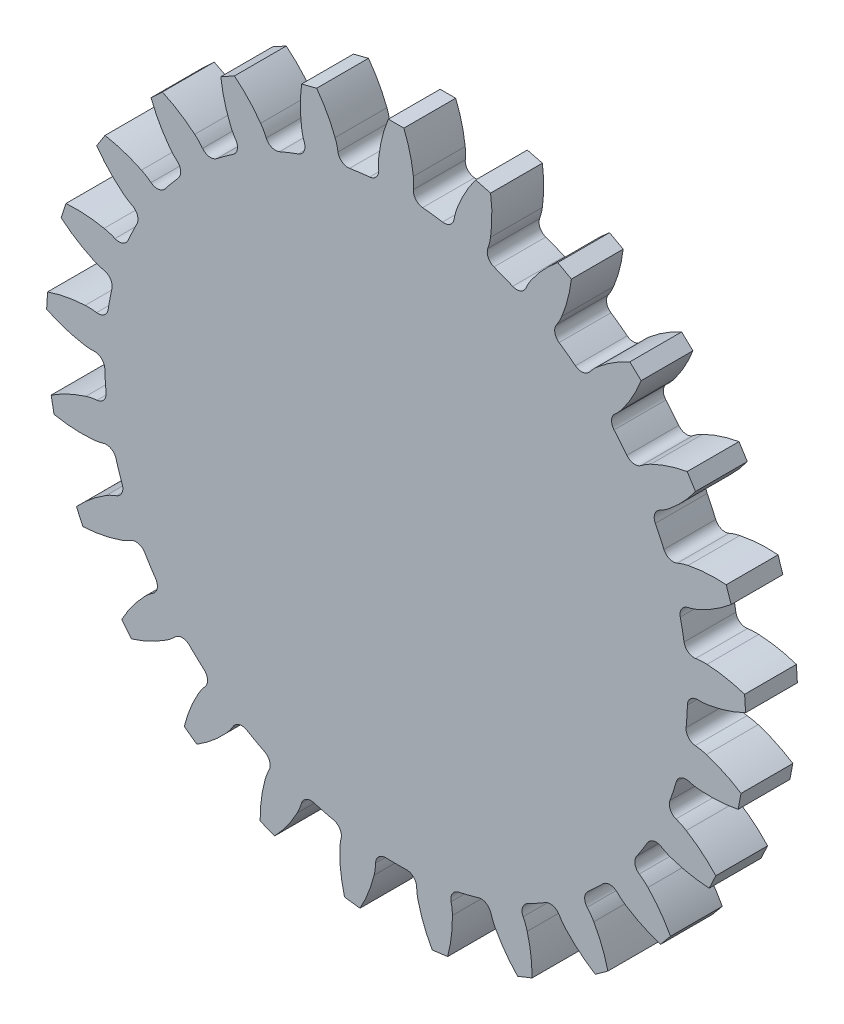
from build123d import *

# Parameters (mm, degrees)
EXTRUDE_1_DEPTH = 3


with BuildPart() as part:
    # 草图1 → 凸台-拉伸1 (new body)
    with BuildSketch(Plane.XY.offset(3)):
        with BuildLine():
            Line((17.338520252, 10.470391265), (16.856276136, 11.230286398))
            ThreePointArc((16.856276136, 11.230286398), (15.778076062, 10.959701062), (14.747362308, 10.543334659))
            ThreePointArc((14.747362308, 10.543334659), (14.459005799, 10.384007926), (14.188692914, 10.195685255))
            ThreePointArc((14.188692914, 10.195685255), (13.755799089, 10.077410904), (13.366485285, 10.300616298))
            ThreePointArc((13.366485285, 10.300616298), (13.002410972, 10.756529827), (12.622793648, 11.19958506))
            ThreePointArc((12.622793648, 11.19958506), (12.476491968, 11.623827566), (12.673787568, 12.026891248))
            ThreePointArc((12.673787568, 12.026891248), (12.909426112, 12.257127998), (13.119963351, 12.510522069))
            ThreePointArc((13.119963351, 12.510522069), (13.722091259, 13.444959765), (14.189918332, 14.453359315))
            Line((14.189918332, 14.453359315), (13.533846568, 15.06945171))
            ThreePointArc((13.533846568, 15.06945171), (12.556811968, 14.539229855), (11.662026096, 13.879616281))
            ThreePointArc((11.662026096, 13.879616281), (11.422351784, 13.653583743), (11.207365219, 13.403953493))
            ThreePointArc((11.207365219, 13.403953493), (10.817485185, 13.181738633), (10.384893466, 13.301113213))
            ThreePointArc((10.384893466, 13.301113213), (9.918876132, 13.65216178), (9.441001829, 13.986890629))
            ThreePointArc((9.441001829, 13.986890629), (9.193791665, 14.361421028), (9.284650999, 14.800887144))
            ThreePointArc((9.284650999, 14.800887144), (9.455628973, 15.082491506), (9.596535255, 15.380283219))
            ThreePointArc((9.596535255, 15.380283219), (9.947361002, 16.435106957), (10.149711657, 17.528169643))
            Line((10.149711657, 17.528169643), (9.361035645, 17.96174795))
            ThreePointArc((9.361035645, 17.96174795), (8.546557198, 17.205205365), (7.843921895, 16.343790567))
            ThreePointArc((7.843921895, 16.343790567), (7.667989398, 16.065254679), (7.52183755, 15.770002038))
            ThreePointArc((7.52183755, 15.770002038), (7.199468903, 15.457809245), (6.750780597, 15.465852266))
            ThreePointArc((6.750780597, 15.465852266), (6.212101827, 15.689978199), (5.665997144, 15.895348419))
            ThreePointArc((5.665997144, 15.895348419), (5.333411618, 16.196633589), (5.312125661, 16.644888866))
            ThreePointArc((5.312125661, 16.644888866), (5.40769989, 16.960166603), (5.470121555, 17.283644609))
            ThreePointArc((5.470121555, 17.283644609), (5.54760147, 18.392575935), (5.471761271, 19.501620609))
            Line((5.471761271, 19.501620609), (4.600036426, 19.725441507))
            ThreePointArc((4.600036426, 19.725441507), (3.999290807, 18.790114546), (3.532955233, 17.781024383))
            ThreePointArc((3.532955233, 17.781024383), (3.431819037, 17.467486579), (3.363685164, 17.145163357))
            ThreePointArc((3.363685164, 17.145163357), (3.129083511, 16.762608851), (2.692491356, 16.658814943))
            ThreePointArc((2.692491356, 16.658814943), (2.114998316, 16.741935585), (1.534977019, 16.805043009))
            ThreePointArc((1.534977019, 16.805043009), (1.137913705, 17.014152095), (1.005819931, 17.443031006))
            ThreePointArc((1.005819931, 17.443031006), (1.019985135, 17.772172057), (1, 18.101011043))
            ThreePointArc((1, 18.101011043), (0.799265734, 19.194371724), (0.45, 20.249713029))
            Line((0.45, 20.249713029), (-0.45, 20.249713029))
            ThreePointArc((-0.45, 20.249713029), (-0.799265734, 19.194371724), (-1, 18.101011043))
            ThreePointArc((-1, 18.101011043), (-1.019985135, 17.772172057), (-1.005819931, 17.443031006))
            ThreePointArc((-1.005819931, 17.443031006), (-1.137913705, 17.014152095), (-1.534977019, 16.805043009))
            ThreePointArc((-1.534977019, 16.805043009), (-2.114998316, 16.741935585), (-2.692491356, 16.658814943))
            ThreePointArc((-2.692491356, 16.658814943), (-3.129083511, 16.762608851), (-3.363685164, 17.145163357))
            ThreePointArc((-3.363685164, 17.145163357), (-3.431819037, 17.467486579), (-3.532955233, 17.781024383))
            ThreePointArc((-3.532955233, 17.781024383), (-3.999290807, 18.790114546), (-4.600036426, 19.725441507))
            Line((-4.600036426, 19.725441507), (-5.471761271, 19.501620609))
            ThreePointArc((-5.471761271, 19.501620609), (-5.54760147, 18.392575935), (-5.470121555, 17.283644609))
            ThreePointArc((-5.470121555, 17.283644609), (-5.40769989, 16.960166603), (-5.312125661, 16.644888866))
            ThreePointArc((-5.312125661, 16.644888866), (-5.333411618, 16.196633589), (-5.665997144, 15.895348419))
            ThreePointArc((-5.665997144, 15.895348419), (-6.212101827, 15.689978199), (-6.750780597, 15.465852266))
            ThreePointArc((-6.750780597, 15.465852266), (-7.199468903, 15.457809245), (-7.52183755, 15.770002038))
            ThreePointArc((-7.52183755, 15.770002038), (-7.667989398, 16.065254679), (-7.843921895, 16.343790567))
            ThreePointArc((-7.843921895, 16.343790567), (-8.546557198, 17.205205365), (-9.361035645, 17.96174795))
            Line((-9.361035645, 17.96174795), (-10.149711657, 17.528169643))
            ThreePointArc((-10.149711657, 17.528169643), (-9.947361002, 16.435106957), (-9.596535255, 15.380283218))
            ThreePointArc((-9.596535255, 15.380283218), (-9.455628973, 15.082491506), (-9.284650999, 14.800887144))
            ThreePointArc((-9.284650999, 14.800887144), (-9.193791665, 14.361421028), (-9.441001829, 13.986890629))
            ThreePointArc((-9.441001829, 13.986890629), (-9.918876132, 13.65216178), (-10.384893466, 13.301113213))
            ThreePointArc((-10.384893466, 13.301113213), (-10.817485185, 13.181738633), (-11.207365219, 13.403953493))
            ThreePointArc((-11.207365219, 13.403953493), (-11.422351784, 13.653583743), (-11.662026096, 13.879616281))
            ThreePointArc((-11.662026096, 13.879616281), (-12.556811968, 14.539229855), (-13.533846568, 15.06945171))
            Line((-13.533846568, 15.06945171), (-14.189918332, 14.453359315))
            ThreePointArc((-14.189918332, 14.453359315), (-13.722091259, 13.444959765), (-13.119963351, 12.510522069))
            ThreePointArc((-13.119963351, 12.510522069), (-12.909426112, 12.257127998), (-12.673787568, 12.026891248))
            ThreePointArc((-12.673787568, 12.026891248), (-12.476491968, 11.623827566), (-12.622793648, 11.19958506))
            ThreePointArc((-12.622793648, 11.19958506), (-13.002410972, 10.756529827), (-13.366485285, 10.300616298))
            ThreePointArc((-13.366485285, 10.300616298), (-13.755799089, 10.077410904), (-14.188692914, 10.195685255))
            ThreePointArc((-14.188692914, 10.195685255), (-14.459005799, 10.384007926), (-14.747362309, 10.543334659))
            ThreePointArc((-14.747362309, 10.543334659), (-15.778076062, 10.959701062), (-16.856276136, 11.230286398))
            Line((-16.856276136, 11.230286398), (-17.338520252, 10.470391265))
            ThreePointArc((-17.338520252, 10.470391265), (-16.634612056, 9.610016303), (-15.819015898, 8.854678808))
            ThreePointArc((-15.819015898, 8.854678808), (-15.552076531, 8.66160406), (-15.266583454, 8.497201543))
            ThreePointArc((-15.266583454, 8.497201543), (-14.975248396, 8.155866269), (-15.011448919, 7.708568373))
            ThreePointArc((-15.011448919, 7.708568373), (-15.26895651, 7.185025545), (-15.508211676, 6.652893778))
            ThreePointArc((-15.508211676, 6.652893778), (-15.829785546, 6.339882386), (-16.27849285, 6.346784614))
            ThreePointArc((-16.27849285, 6.346784614), (-16.587147303, 6.461966702), (-16.90606751, 6.544576544))
            ThreePointArc((-16.90606751, 6.544576544), (-18.007945609, 6.691533944), (-19.119563882, 6.68548089))
            Line((-19.119563882, 6.68548089), (-19.397679177, 5.829530025))
            ThreePointArc((-19.397679177, 5.829530025), (-18.501918999, 5.171240174), (-17.524101498, 4.642463511))
            ThreePointArc((-17.524101498, 4.642463511), (-17.217532784, 4.521839683), (-16.900123754, 4.433601415))
            ThreePointArc((-16.900123754, 4.433601415), (-16.533054892, 4.175441898), (-16.456879646, 3.733193984))
            ThreePointArc((-16.456879646, 3.733193984), (-16.576097356, 3.162059684), (-16.675500091, 2.587145474))
            ThreePointArc((-16.675500091, 2.587145474), (-16.90912836, 2.203995742), (-17.345455213, 2.099092154))
            ThreePointArc((-17.345455213, 2.099092154), (-17.673057339, 2.133896344), (-18.002502313, 2.134598616))
            ThreePointArc((-18.002502313, 2.134598616), (-19.106309705, 2.002913139), (-20.181499112, 1.720602029))
            Line((-20.181499112, 1.720602029), (-20.23801058, 0.822377974))
            ThreePointArc((-20.23801058, 0.822377974), (-19.206682327, 0.407536007), (-18.128083352, 0.138545159))
            ThreePointArc((-18.128083352, 0.138545159), (-17.801148132, 0.097951489), (-17.471767125, 0.091421804))
            ThreePointArc((-17.471767125, 0.091421804), (-17.052028745, -0.067340843), (-16.8682641, -0.476750712))
            ThreePointArc((-16.8682641, -0.476750712), (-16.841701042, -1.059590017), (-16.795005508, -1.641162694))
            ThreePointArc((-16.795005508, -1.641162694), (-16.926008451, -2.070376061), (-17.322538832, -2.280493986))
            ThreePointArc((-17.322538832, -2.280493986), (-17.648504185, -2.328254569), (-17.967773687, -2.409503994))
            ThreePointArc((-17.967773687, -2.409503994), (-19.004154094, -2.811558065), (-19.975356531, -3.352388585))
            Line((-19.975356531, -3.352388585), (-19.806713348, -4.23644711))
            ThreePointArc((-19.806713348, -4.23644711), (-18.704619166, -4.381775147), (-17.593011058, -4.374078495))
            ThreePointArc((-17.593011058, -4.374078495), (-17.266251874, -4.332091357), (-16.945595111, -4.256502175))
            ThreePointArc((-16.945595111, -4.256502175), (-16.499560919, -4.305892311), (-16.219753484, -4.656739407))
            ThreePointArc((-16.219753484, -4.656739407), (-16.049078712, -5.21466178), (-15.859218961, -5.766350575))
            ThreePointArc((-15.859218961, -5.766350575), (-15.879365182, -6.214658522), (-16.211183629, -6.516788301))
            ThreePointArc((-16.211183629, -6.516788301), (-16.515030607, -6.644112684), (-16.80406376, -6.802208606))
            ThreePointArc((-16.80406376, -6.802208606), (-17.707897589, -7.449368736), (-18.514088835, -8.214736294))
            Line((-18.514088835, -8.214736294), (-18.130887472, -9.029080642))
            ThreePointArc((-18.130887472, -9.029080642), (-17.027275993, -8.895763253), (-15.952505177, -8.611862711))
            ThreePointArc((-15.952505177, -8.611862711), (-15.64645351, -8.489932971), (-15.354669034, -8.336974468))
            ThreePointArc((-15.354669034, -8.336974468), (-14.910364999, -8.273888729), (-14.552096105, -8.544128039))
            ThreePointArc((-14.552096105, -8.544128039), (-14.248033743, -9.042077165), (-13.92693936, -9.529217442))
            ThreePointArc((-13.92693936, -9.529217442), (-13.834962998, -9.968451132), (-14.081220138, -10.343608841))
            ThreePointArc((-14.081220138, -10.343608841), (-14.343856917, -10.542496765), (-14.584492706, -10.767505435))
            ThreePointArc((-14.584492706, -10.767505435), (-15.298988753, -11.619108172), (-15.889512847, -12.560921911))
            Line((-15.889512847, -12.560921911), (-15.315831256, -13.25438383))
            ThreePointArc((-15.315831256, -13.25438383), (-14.280046447, -12.850797838), (-13.309644727, -12.30853192))
            ThreePointArc((-13.309644727, -12.30853192), (-13.043530928, -12.114320873), (-12.798952631, -11.893603994))
            ThreePointArc((-12.798952631, -11.893603994), (-12.38429601, -11.72200629), (-11.970077008, -11.894657684))
            ThreePointArc((-11.970077008, -11.894657684), (-11.551732413, -12.301345588), (-11.11957894, -12.693328531))
            ThreePointArc((-11.11957894, -12.693328531), (-10.921259207, -13.095889296), (-11.066481798, -13.520502395))
            ThreePointArc((-11.066481798, -13.520502395), (-11.271405945, -13.778457001), (-11.448524337, -14.056240297))
            ThreePointArc((-11.448524337, -14.056240297), (-11.928788188, -15.05877631), (-12.266540329, -16.117858608))
            Line((-12.266540329, -16.117858608), (-11.538425034, -16.646865335))
            ThreePointArc((-11.538425034, -16.646865335), (-10.635549064, -15.998369532), (-9.830490348, -15.231810801))
            ThreePointArc((-9.830490348, -15.231810801), (-9.621035328, -14.977521441), (-9.439030963, -14.702914639))
            ThreePointArc((-9.439030963, -14.702914639), (-9.080076156, -14.433587084), (-8.63593395, -14.49780224))
            ThreePointArc((-8.63593395, -14.49780224), (-8.12959325, -14.787675226), (-7.61353448, -15.059871106))
            ThreePointArc((-7.61353448, -15.059871106), (-7.321332535, -15.400464572), (-7.356395707, -15.84785306))
            ThreePointArc((-7.356395707, -15.84785306), (-7.490731083, -16.14866611), (-7.593203079, -16.461769886))
            ThreePointArc((-7.593203079, -16.461769886), (-7.809057991, -17.552246149), (-7.87281597, -18.662050972))
            Line((-7.87281597, -18.662050972), (-7.036017132, -18.993363069))
            ThreePointArc((-7.036017132, -18.993363069), (-6.322781019, -18.140704831), (-5.733650107, -17.198018991))
            ThreePointArc((-5.733650107, -17.198018991), (-5.594014694, -16.899629253), (-5.486020266, -16.588387084))
            ThreePointArc((-5.486020266, -16.588387084), (-5.205321723, -16.238252519), (-4.759163402, -16.189996563))
            ThreePointArc((-4.759163402, -16.189996563), (-4.196641846, -16.344840844), (-3.629103648, -16.480146593))
            ThreePointArc((-3.629103648, -16.480146593), (-3.261379614, -16.73737202), (-3.18408022, -17.179424832))
            ThreePointArc((-3.18408022, -17.179424832), (-3.239386039, -17.504195137), (-3.260772946, -17.832945931))
            ThreePointArc((-3.260772946, -17.832945931), (-3.19865596, -18.942843811), (-2.984413628, -20.033638039))
            Line((-2.984413628, -20.033638039), (-2.091510397, -20.146437949))
            ThreePointArc((-2.091510397, -20.146437949), (-1.612729389, -19.143192929), (-1.276543544, -18.083612398))
            ThreePointArc((-1.276543544, -18.083612398), (-1.215501544, -17.759871207), (-1.188302739, -17.431550161))
            ThreePointArc((-1.188302739, -17.431550161), (-1.003497783, -17.022608828), (-0.583357113, -16.864913859))
            ThreePointArc((-0.583357113, -16.864913859), (0, -16.875), (0.583357113, -16.864913859))
            ThreePointArc((0.583357113, -16.864913859), (1.003497783, -17.022608828), (1.188302739, -17.431550161))
            ThreePointArc((1.188302739, -17.431550161), (1.215501544, -17.759871207), (1.276543543, -18.083612398))
            ThreePointArc((1.276543543, -18.083612398), (1.612729389, -19.143192929), (2.091510397, -20.146437949))
            Line((2.091510397, -20.146437949), (2.984413628, -20.033638039))
            ThreePointArc((2.984413628, -20.033638039), (3.19865596, -18.942843811), (3.260772946, -17.832945931))
            ThreePointArc((3.260772946, -17.832945931), (3.239386039, -17.504195137), (3.18408022, -17.179424832))
            ThreePointArc((3.18408022, -17.179424832), (3.261379614, -16.73737202), (3.629103648, -16.480146593))
            ThreePointArc((3.629103648, -16.480146593), (4.196641846, -16.344840844), (4.759163402, -16.189996563))
            ThreePointArc((4.759163402, -16.189996563), (5.205321723, -16.238252519), (5.486020266, -16.588387084))
            ThreePointArc((5.486020266, -16.588387084), (5.594014694, -16.899629253), (5.733650107, -17.198018991))
            ThreePointArc((5.733650107, -17.198018991), (6.322781019, -18.140704831), (7.036017132, -18.993363069))
            Line((7.036017132, -18.993363069), (7.87281597, -18.662050972))
            ThreePointArc((7.87281597, -18.662050972), (7.809057991, -17.552246149), (7.593203079, -16.461769886))
            ThreePointArc((7.593203079, -16.461769886), (7.490731083, -16.14866611), (7.356395707, -15.84785306))
            ThreePointArc((7.356395707, -15.84785306), (7.321332535, -15.400464572), (7.61353448, -15.059871106))
            ThreePointArc((7.61353448, -15.059871106), (8.12959325, -14.787675226), (8.63593395, -14.49780224))
            ThreePointArc((8.63593395, -14.49780224), (9.080076156, -14.433587084), (9.439030963, -14.702914639))
            ThreePointArc((9.439030963, -14.702914639), (9.621035328, -14.977521441), (9.830490348, -15.231810801))
            ThreePointArc((9.830490348, -15.231810801), (10.635549064, -15.998369532), (11.538425034, -16.646865335))
            Line((11.538425034, -16.646865335), (12.266540329, -16.117858608))
            ThreePointArc((12.266540329, -16.117858608), (11.928788188, -15.05877631), (11.448524337, -14.056240297))
            ThreePointArc((11.448524337, -14.056240297), (11.271405945, -13.778457001), (11.066481798, -13.520502395))
            ThreePointArc((11.066481798, -13.520502395), (10.921259207, -13.095889296), (11.11957894, -12.693328531))
            ThreePointArc((11.11957894, -12.693328531), (11.551732413, -12.301345588), (11.970077008, -11.894657684))
            ThreePointArc((11.970077008, -11.894657684), (12.38429601, -11.72200629), (12.798952631, -11.893603994))
            ThreePointArc((12.798952631, -11.893603994), (13.043530928, -12.114320873), (13.309644727, -12.30853192))
            ThreePointArc((13.309644727, -12.30853192), (14.280046447, -12.850797838), (15.315831256, -13.25438383))
            Line((15.315831256, -13.25438383), (15.889512847, -12.560921911))
            ThreePointArc((15.889512847, -12.560921911), (15.298988753, -11.619108172), (14.584492706, -10.767505435))
            ThreePointArc((14.584492706, -10.767505435), (14.343856917, -10.542496765), (14.081220138, -10.343608841))
            ThreePointArc((14.081220138, -10.343608841), (13.834962998, -9.968451132), (13.92693936, -9.529217442))
            ThreePointArc((13.92693936, -9.529217442), (14.248033743, -9.042077165), (14.552096105, -8.544128039))
            ThreePointArc((14.552096105, -8.544128039), (14.910364999, -8.273888729), (15.354669034, -8.336974468))
            ThreePointArc((15.354669034, -8.336974468), (15.64645351, -8.489932971), (15.952505177, -8.611862711))
            ThreePointArc((15.952505177, -8.611862711), (17.027275993, -8.895763253), (18.130887472, -9.029080642))
            Line((18.130887472, -9.029080642), (18.514088835, -8.214736294))
            ThreePointArc((18.514088835, -8.214736294), (17.707897589, -7.449368736), (16.80406376, -6.802208606))
            ThreePointArc((16.80406376, -6.802208606), (16.515030607, -6.644112684), (16.211183629, -6.516788301))
            ThreePointArc((16.211183629, -6.516788301), (15.879365182, -6.214658522), (15.859218961, -5.766350575))
            ThreePointArc((15.859218961, -5.766350575), (16.049078712, -5.21466178), (16.219753484, -4.656739407))
            ThreePointArc((16.219753484, -4.656739407), (16.499560919, -4.305892311), (16.94559511, -4.256502175))
            ThreePointArc((16.94559511, -4.256502175), (17.266251874, -4.332091357), (17.593011058, -4.374078495))
            ThreePointArc((17.593011058, -4.374078495), (18.704619166, -4.381775147), (19.806713348, -4.23644711))
            Line((19.806713348, -4.23644711), (19.975356531, -3.352388585))
            ThreePointArc((19.975356531, -3.352388585), (19.004154094, -2.811558065), (17.967773687, -2.409503994))
            ThreePointArc((17.967773687, -2.409503994), (17.648504185, -2.328254569), (17.322538832, -2.280493986))
            ThreePointArc((17.322538832, -2.280493986), (16.926008451, -2.070376061), (16.795005508, -1.641162694))
            ThreePointArc((16.795005508, -1.641162694), (16.841701042, -1.059590017), (16.8682641, -0.476750712))
            ThreePointArc((16.8682641, -0.476750712), (17.052028745, -0.067340843), (17.471767125, 0.091421804))
            ThreePointArc((17.471767125, 0.091421804), (17.801148132, 0.097951489), (18.128083352, 0.138545159))
            ThreePointArc((18.128083352, 0.138545159), (19.206682327, 0.407536007), (20.23801058, 0.822377974))
            Line((20.23801058, 0.822377974), (20.181499112, 1.720602029))
            ThreePointArc((20.181499112, 1.720602029), (19.106309705, 2.002913139), (18.002502313, 2.134598616))
            ThreePointArc((18.002502313, 2.134598616), (17.673057339, 2.133896344), (17.345455213, 2.099092154))
            ThreePointArc((17.345455213, 2.099092154), (16.90912836, 2.203995742), (16.675500091, 2.587145474))
            ThreePointArc((16.675500091, 2.587145474), (16.576097356, 3.162059684), (16.456879646, 3.733193984))
            ThreePointArc((16.456879646, 3.733193984), (16.533054892, 4.175441898), (16.900123754, 4.433601415))
            ThreePointArc((16.900123754, 4.433601415), (17.217532784, 4.521839683), (17.524101498, 4.642463511))
            ThreePointArc((17.524101498, 4.642463511), (18.501918999, 5.171240174), (19.397679177, 5.829530025))
            Line((19.397679177, 5.829530025), (19.119563882, 6.68548089))
            ThreePointArc((19.119563882, 6.68548089), (18.007945609, 6.691533944), (16.90606751, 6.544576544))
            ThreePointArc((16.90606751, 6.544576544), (16.587147303, 6.461966702), (16.27849285, 6.346784614))
            ThreePointArc((16.27849285, 6.346784614), (15.829785546, 6.339882386), (15.508211676, 6.652893778))
            ThreePointArc((15.508211676, 6.652893778), (15.26895651, 7.185025545), (15.011448919, 7.708568373))
            ThreePointArc((15.011448919, 7.708568373), (14.975248396, 8.155866269), (15.266583454, 8.497201543))
            ThreePointArc((15.266583454, 8.497201543), (15.552076531, 8.66160406), (15.819015898, 8.854678808))
            ThreePointArc((15.819015898, 8.854678808), (16.634612056, 9.610016303), (17.338520252, 10.470391265))
        make_face()
    extrude(amount=-EXTRUDE_1_DEPTH)


solid = part.part
